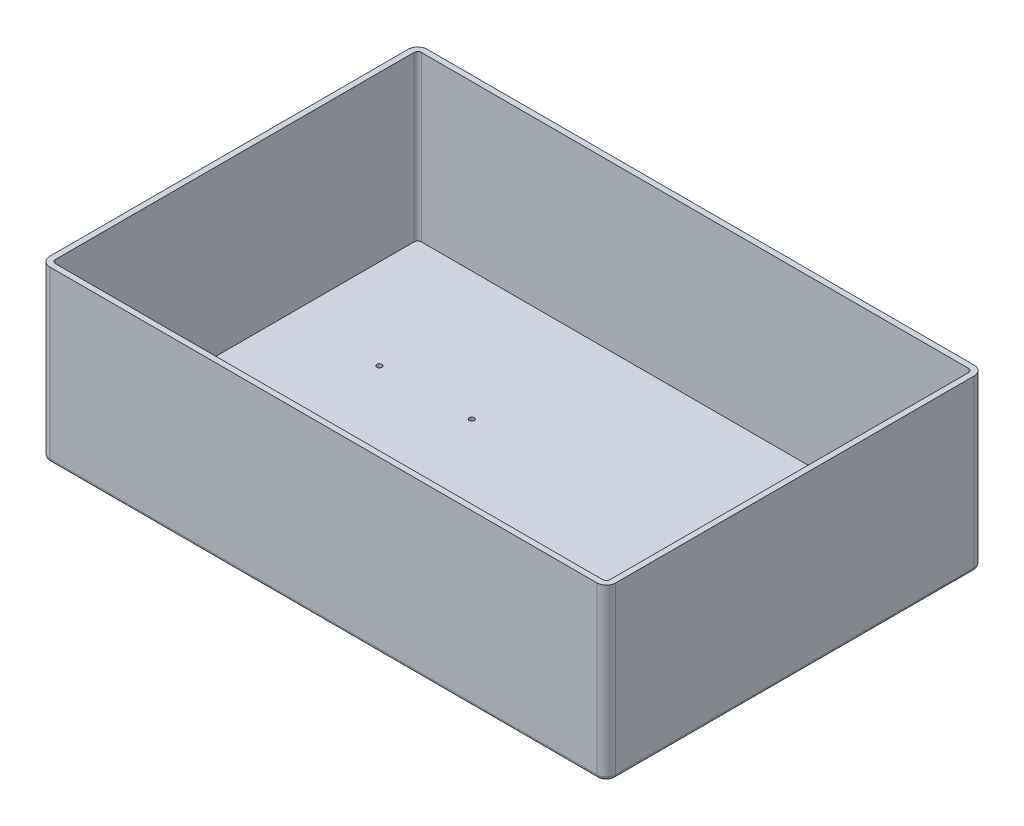
from build123d import *

# Parameters (mm, degrees)
BOSS_EXTRUDE1_DEPTH = 90
SHELL1_T            = -3
FILLET1_R           = 2
SKETCH3_R           = 1.35
CUT_EXTRUDE1_DEPTH  = 3


with BuildPart() as part:
    # Sketch2 → Boss-Extrude1 (new body)
    with BuildSketch(Plane(origin=(0, 0, 0), x_dir=(1, 0, 0), z_dir=(0, 1, 0))):
        with BuildLine():
            Line((-145, 100), (145, 100))
            ThreePointArc((145, 100), (148.535533906, 98.535533906), (150, 95))
            Line((150, 95), (150, -95))
            ThreePointArc((150, -95), (148.535533906, -98.535533906), (145, -100))
            Line((145, -100), (-145, -100))
            ThreePointArc((-145, -100), (-148.535533906, -98.535533906), (-150, -95))
            Line((-150, -95), (-150, 95))
            ThreePointArc((-150, 95), (-148.535533906, 98.535533906), (-145, 100))
        make_face()
    extrude(amount=BOSS_EXTRUDE1_DEPTH)

    # Shell1
    shell1_openings = [part.faces().sort_by_distance(p)[0] for p in [
        (0, 90, 0),
    ]]
    offset(amount=SHELL1_T, openings=shell1_openings, kind=Kind.INTERSECTION)

    # Fillet1
    fillet1_edges = [part.edges().sort_by_distance(p)[0] for p in [
        (150, 0, 0),
        (148.535533906, 0, 98.535533906),
        (0, 0, 100),
        (-148.535533906, 0, 98.535533906),
        (-150, 0, 0),
        (-148.535533906, 0, -98.535533906),
        (0, 0, -100),
        (148.535533906, 0, -98.535533906),
    ]]
    fillet(fillet1_edges, radius=FILLET1_R)

    # Sketch3 → Cut-Extrude1 (cut)
    with BuildSketch(Plane(origin=(0, 3, 0), x_dir=(1, 0, 0), z_dir=(0, 1, 0))):
        with Locations(Location((-99.315591438, -29, 0), (0, 0, 270))):
            Circle(SKETCH3_R)
        with Locations(Location((-50.315591438, -29, 0), (0, 0, 270))):
            Circle(SKETCH3_R)
        with Locations(Location((-50.315591438, 29, 0), (0, 0, 270))):
            Circle(SKETCH3_R)
        with Locations(Location((-99.315591438, 29, 0), (0, 0, 270))):
            Circle(SKETCH3_R)
        with Locations(Location((87.050591438, -12.235, 0), (0, 0, 270))):
            Circle(SKETCH3_R)
        with Locations(Location((87.050591438, 12.235, 0), (0, 0, 270))):
            Circle(SKETCH3_R)
        with Locations(Location((62.580591438, 12.235, 0), (0, 0, 270))):
            Circle(SKETCH3_R)
        with Locations(Location((62.580591438, -12.235, 0), (0, 0, 270))):
            Circle(SKETCH3_R)
    extrude(amount=-CUT_EXTRUDE1_DEPTH, mode=Mode.SUBTRACT)


solid = part.part
